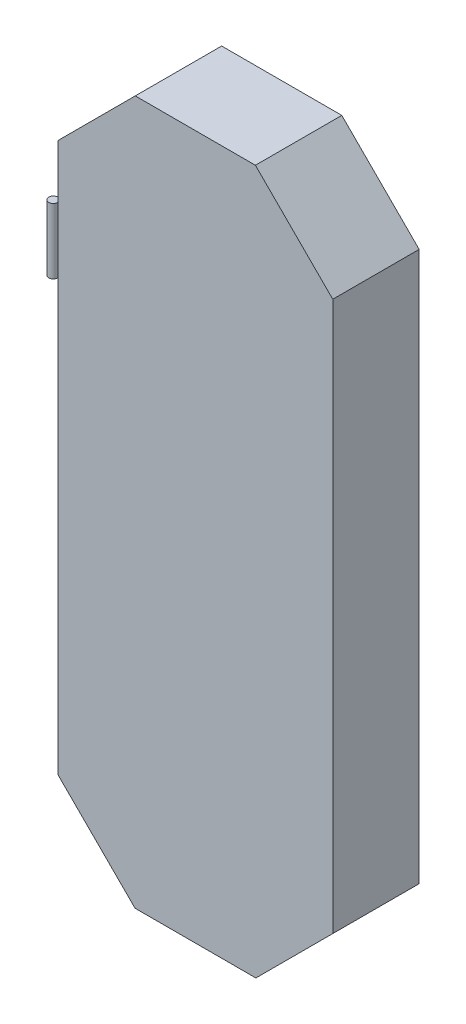
from build123d import *

# Parameters (mm, degrees)
EXTRUDE_1_DEPTH     = 66
SKETCH1_R           = 3.5
BOSS_EXTRUDE1_DEPTH = 50
SKETCH2_R           = 42
BOSS_EXTRUDE2_DEPTH = 21
SKETCH3_R           = 15
CUT_EXTRUDE1_DEPTH  = 20


with BuildPart() as part:
    # Эскиз1 → Вытянуть1 (new body)
    with BuildSketch(Plane.XY):
        Polygon((105.082921559, 581.722068254), (45.979042749, 640.825947064), (-45.813199631, 640.825947064), (-104.917078441, 581.722068254), (-104.917078441, 162.212880509), (-45.97317451, 103.268976578), (46.326817337, 103.268976578), (105.082921559, 162.0250808), align=None)
    extrude(amount=EXTRUDE_1_DEPTH)

    # Sketch2 → Boss-Extrude2 (add)
    with BuildSketch(Plane(origin=(0, 0, 0), x_dir=(-1, 0, 0), z_dir=(0, 0, -1))):
        with Locations(Location((-0.082921559, 539.825947064, 0), (0, 0, 180))):
            Circle(SKETCH2_R)
    extrude(amount=BOSS_EXTRUDE2_DEPTH)

    # Sketch3 → Cut-Extrude1 (cut)
    with BuildSketch(Plane(origin=(0, 0, -21), x_dir=(-1, 0, 0), z_dir=(0, 0, -1))):
        with Locations((-0.082921559, 539.825947064)):
            Circle(SKETCH3_R)
    extrude(amount=-CUT_EXTRUDE1_DEPTH, mode=Mode.SUBTRACT)


with BuildPart() as body_2:
    # Sketch1 → Boss-Extrude1 (new body)
    with BuildSketch(Plane(origin=(0, 490.825947064, 0), x_dir=(1, 0, 0), z_dir=(0, 1, 0))):
        with Locations(Location((-108.417078441, -66, 0), (0, 0, 180))):
            Circle(SKETCH1_R)
    extrude(amount=BOSS_EXTRUDE1_DEPTH)


solid = Compound([part.part, body_2.part])
